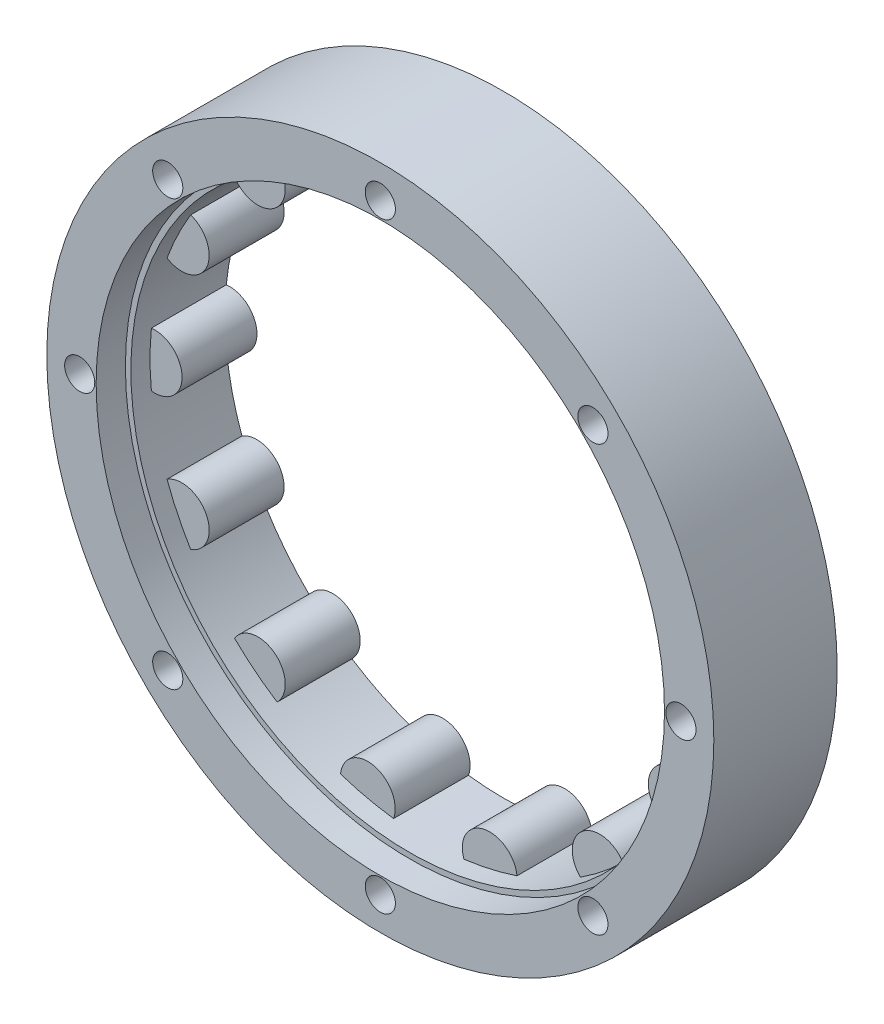
from build123d import *

# Parameters (mm, degrees)
PINSBASEEXTRUDE_DEPTH      = 0.2
PINSBASEEXTRUDE_DEPTH_BACK = 0.2
PINSBASESKETCH_R           = 33
PINSEXTRUDE_START          = -0.2
PINSSKETCH_R               = 3
PINSEXTRUDE_DEPTH          = 8.6
PINSPATTERN_COUNT          = 14
BOREREVOLVESKETCH_W        = 4
BOREREVOLVESKETCH_H        = 7.5
SKETCH_4_R                 = 33
CUT_EXTRUDE_1_DEPTH        = 0.4
SKETCH_5_R                 = 36.5
SKETCH_5_R_2               = 30.5
EXTRUDE_3_DEPTH            = 13.5
CUT_EXTRUDE_2_REACH        = 55.355
SKETCH_6_R                 = 1.65
SKETCH_8_R                 = 31.1
CUT_EXTRUDE_3_DEPTH        = 3.2


with BuildPart() as part:
    # PinsBaseSketch → PinsBaseExtrude (new, two sides: drawn at the far end of the back side and taken through both)
    with BuildSketch(Plane.XY.offset(-PINSBASEEXTRUDE_DEPTH_BACK)):
        Circle(PINSBASESKETCH_R)
    extrude(amount=PINSBASEEXTRUDE_DEPTH + PINSBASEEXTRUDE_DEPTH_BACK)

    # PinsSketch → PinsExtrude (add)
    with BuildSketch(Plane.XY.offset(PINSEXTRUDE_START)):
        with Locations((30, 0)):
            Circle(PINSSKETCH_R)
    pinsextrude = extrude(amount=PINSEXTRUDE_DEPTH)

    # PinsPattern: PinsExtrude ×14 about axis
    pinspattern_axis = Axis((0, 0, 55), (0, 0, -1))
    for i in range(1, PINSPATTERN_COUNT):
        add(pinsextrude.rotate(pinspattern_axis, i * 360 / PINSPATTERN_COUNT))

    # BoreRevolveSketch → BoreRevolveCut (revolve, cut)
    with BuildSketch(Plane(origin=(0, 0, 0), x_dir=(0, 0, -1), z_dir=(1, 0, 0))):
        with Locations((0, 3.75)):
            Rectangle(BOREREVOLVESKETCH_W, BOREREVOLVESKETCH_H)
    revolve(axis=Axis((0, 0, 0), (0, 0, -1)), mode=Mode.SUBTRACT)

    # 草图4 → 切除-拉伸1 (cut)
    with BuildSketch(Plane(origin=(0, 0, -0.2), x_dir=(-1, 0, 0), z_dir=(0, 0, -1))):
        Circle(SKETCH_4_R)
    extrude(amount=-CUT_EXTRUDE_1_DEPTH, mode=Mode.SUBTRACT)


with BuildPart() as cut_extrude_1_piece_1:
    # of the separate pieces the step leaves, piece 1, a body of its own (cut_extrude_1_pieces)
    add(part.part.solids().sort_by_distance((7.343190821, 32.172621102, 0.2))[0])



with BuildPart() as cut_extrude_1_piece_2:
    # of the separate pieces the step leaves, piece 2, a body of its own (cut_extrude_1_pieces)
    add(part.part.solids().sort_by_distance((20.575163461, -25.800438921, 0.2))[0])


with BuildPart() as cut_extrude_1_piece_3:
    # of the separate pieces the step leaves, piece 3, a body of its own (cut_extrude_1_pieces)
    add(part.part.solids().sort_by_distance((-7.343190821, 32.172621102, 0.2))[0])


with BuildPart() as cut_extrude_1_piece_4:
    # of the separate pieces the step leaves, piece 4, a body of its own (cut_extrude_1_pieces)
    add(part.part.solids().sort_by_distance((20.575163461, 25.800438921, 0.2))[0])


with BuildPart() as cut_extrude_1_piece_5:
    # of the separate pieces the step leaves, piece 5, a body of its own (cut_extrude_1_pieces)
    add(part.part.solids().sort_by_distance((29.731972641, 14.318163391, 0.2))[0])


with BuildPart() as cut_extrude_1_piece_6:
    # of the separate pieces the step leaves, piece 6, a body of its own (cut_extrude_1_pieces)
    add(part.part.solids().sort_by_distance((-7.343190821, -32.172621102, 0.2))[0])


with BuildPart() as cut_extrude_1_piece_7:
    # of the separate pieces the step leaves, piece 7, a body of its own (cut_extrude_1_pieces)
    add(part.part.solids().sort_by_distance((7.343190821, -32.172621102, 0.2))[0])


with BuildPart() as cut_extrude_1_piece_8:
    # of the separate pieces the step leaves, piece 8, a body of its own (cut_extrude_1_pieces)
    add(part.part.solids().sort_by_distance((29.731972641, -14.318163391, 0.2))[0])


with BuildPart() as cut_extrude_1_piece_9:
    # of the separate pieces the step leaves, piece 9, a body of its own (cut_extrude_1_pieces)
    add(part.part.solids().sort_by_distance((-29.731972641, -14.318163391, 0.2))[0])


with BuildPart() as cut_extrude_1_piece_10:
    # of the separate pieces the step leaves, piece 10, a body of its own (cut_extrude_1_pieces)
    add(part.part.solids().sort_by_distance((33, 0, 0.2))[0])


with BuildPart() as cut_extrude_1_piece_11:
    # of the separate pieces the step leaves, piece 11, a body of its own (cut_extrude_1_pieces)
    add(part.part.solids().sort_by_distance((-20.575163461, 25.800438921, 0.2))[0])


with BuildPart() as cut_extrude_1_piece_12:
    # of the separate pieces the step leaves, piece 12, a body of its own (cut_extrude_1_pieces)
    add(part.part.solids().sort_by_distance((-20.575163461, -25.800438921, 0.2))[0])


with BuildPart() as cut_extrude_1_piece_13:
    # of the separate pieces the step leaves, piece 13, a body of its own (cut_extrude_1_pieces)
    add(part.part.solids().sort_by_distance((-33, 0, 0.2))[0])


with BuildPart() as cut_extrude_1_piece_14:
    # of the separate pieces the step leaves, piece 14, a body of its own (cut_extrude_1_pieces)
    add(part.part.solids().sort_by_distance((-29.731972641, 14.318163391, 0.2))[0])


with BuildPart() as cut_extrude_1_piece_1_1:
    add(cut_extrude_1_piece_1.part)

    add(cut_extrude_1_piece_2.part)  # 凸台-拉伸3 merges 切除-拉伸1 piece 2

    add(cut_extrude_1_piece_3.part)  # 凸台-拉伸3 merges 切除-拉伸1 piece 3

    add(cut_extrude_1_piece_4.part)  # 凸台-拉伸3 merges 切除-拉伸1 piece 4

    add(cut_extrude_1_piece_5.part)  # 凸台-拉伸3 merges 切除-拉伸1 piece 5

    add(cut_extrude_1_piece_6.part)  # 凸台-拉伸3 merges 切除-拉伸1 piece 6

    add(cut_extrude_1_piece_7.part)  # 凸台-拉伸3 merges 切除-拉伸1 piece 7

    add(cut_extrude_1_piece_8.part)  # 凸台-拉伸3 merges 切除-拉伸1 piece 8

    add(cut_extrude_1_piece_9.part)  # 凸台-拉伸3 merges 切除-拉伸1 piece 9

    add(cut_extrude_1_piece_10.part)  # 凸台-拉伸3 merges 切除-拉伸1 piece 10

    add(cut_extrude_1_piece_11.part)  # 凸台-拉伸3 merges 切除-拉伸1 piece 11

    add(cut_extrude_1_piece_12.part)  # 凸台-拉伸3 merges 切除-拉伸1 piece 12

    add(cut_extrude_1_piece_13.part)  # 凸台-拉伸3 merges 切除-拉伸1 piece 13

    add(cut_extrude_1_piece_14.part)  # 凸台-拉伸3 merges 切除-拉伸1 piece 14
    # 草图5 → 凸台-拉伸3 (add)
    with BuildSketch(Plane(origin=(0, 0, 0.2), x_dir=(-1, 0, 0), z_dir=(0, 0, -1))):
        Circle(SKETCH_5_R)
        Circle(SKETCH_5_R_2, mode=Mode.SUBTRACT)
    extrude(amount=-EXTRUDE_3_DEPTH)

    # 草图6 → 切除-拉伸2 (cut, up to next)
    with BuildSketch(Plane.XY.offset(13.7), mode=Mode.PRIVATE) as cut_extrude_2_sk1:
        with Locations((32.899998742, 1.194e-06)):
            Circle(SKETCH_6_R)
    cut_extrude_2_tool1 = extrude(cut_extrude_2_sk1.sketch, amount=-CUT_EXTRUDE_2_REACH, mode=Mode.PRIVATE) & cut_extrude_1_piece_1_1.part
    # 草图6 → 切除-拉伸2 (cut, up to next)
    with BuildSketch(Plane.XY.offset(13.7), mode=Mode.PRIVATE) as cut_extrude_2_sk2:
        with Locations((23.263811843, -23.263811907)):
            Circle(SKETCH_6_R)
    cut_extrude_2_tool2 = extrude(cut_extrude_2_sk2.sketch, amount=-CUT_EXTRUDE_2_REACH, mode=Mode.PRIVATE) & cut_extrude_1_piece_1_1.part
    # 草图6 → 切除-拉伸2 (cut, up to next)
    with BuildSketch(Plane.XY.offset(13.7), mode=Mode.PRIVATE) as cut_extrude_2_sk3:
        with Locations((-1.258e-06, -32.899998806)):
            Circle(SKETCH_6_R)
    cut_extrude_2_tool3 = extrude(cut_extrude_2_sk3.sketch, amount=-CUT_EXTRUDE_2_REACH, mode=Mode.PRIVATE) & cut_extrude_1_piece_1_1.part
    # 草图6 → 切除-拉伸2 (cut, up to next)
    with BuildSketch(Plane.XY.offset(13.7), mode=Mode.PRIVATE) as cut_extrude_2_sk4:
        with Locations((-23.263814359, -23.263811907)):
            Circle(SKETCH_6_R)
    cut_extrude_2_tool4 = extrude(cut_extrude_2_sk4.sketch, amount=-CUT_EXTRUDE_2_REACH, mode=Mode.PRIVATE) & cut_extrude_1_piece_1_1.part
    # 草图6 → 切除-拉伸2 (cut, up to next)
    with BuildSketch(Plane.XY.offset(13.7), mode=Mode.PRIVATE) as cut_extrude_2_sk5:
        with Locations((-32.900001258, 1.194e-06)):
            Circle(SKETCH_6_R)
    cut_extrude_2_tool5 = extrude(cut_extrude_2_sk5.sketch, amount=-CUT_EXTRUDE_2_REACH, mode=Mode.PRIVATE) & cut_extrude_1_piece_1_1.part
    # 草图6 → 切除-拉伸2 (cut, up to next)
    with BuildSketch(Plane.XY.offset(13.7), mode=Mode.PRIVATE) as cut_extrude_2_sk6:
        with Locations((-23.263814359, 23.263814295)):
            Circle(SKETCH_6_R)
    cut_extrude_2_tool6 = extrude(cut_extrude_2_sk6.sketch, amount=-CUT_EXTRUDE_2_REACH, mode=Mode.PRIVATE) & cut_extrude_1_piece_1_1.part
    # 草图6 → 切除-拉伸2 (cut, up to next)
    with BuildSketch(Plane.XY.offset(13.7), mode=Mode.PRIVATE) as cut_extrude_2_sk7:
        with Locations((-1.258e-06, 32.900001194)):
            Circle(SKETCH_6_R)
    cut_extrude_2_tool7 = extrude(cut_extrude_2_sk7.sketch, amount=-CUT_EXTRUDE_2_REACH, mode=Mode.PRIVATE) & cut_extrude_1_piece_1_1.part
    # 草图6 → 切除-拉伸2 (cut, up to next)
    with BuildSketch(Plane.XY.offset(13.7), mode=Mode.PRIVATE) as cut_extrude_2_sk8:
        with Locations((23.263811843, 23.263814295)):
            Circle(SKETCH_6_R)
    cut_extrude_2_tool8 = extrude(cut_extrude_2_sk8.sketch, amount=-CUT_EXTRUDE_2_REACH, mode=Mode.PRIVATE) & cut_extrude_1_piece_1_1.part
    add(cut_extrude_2_tool1.solids().sort_by_distance((32.899999, 1e-06, 13.7))[0], mode=Mode.SUBTRACT)
    add(cut_extrude_2_tool2.solids().sort_by_distance((23.263812, -23.263812, 13.7))[0], mode=Mode.SUBTRACT)
    add(cut_extrude_2_tool3.solids().sort_by_distance((-1e-06, -32.899999, 13.7))[0], mode=Mode.SUBTRACT)
    add(cut_extrude_2_tool4.solids().sort_by_distance((-23.263814, -23.263812, 13.7))[0], mode=Mode.SUBTRACT)
    add(cut_extrude_2_tool5.solids().sort_by_distance((-32.900001, 1e-06, 13.7))[0], mode=Mode.SUBTRACT)
    add(cut_extrude_2_tool6.solids().sort_by_distance((-23.263814, 23.263814, 13.7))[0], mode=Mode.SUBTRACT)
    add(cut_extrude_2_tool7.solids().sort_by_distance((-1e-06, 32.900001, 13.7))[0], mode=Mode.SUBTRACT)
    add(cut_extrude_2_tool8.solids().sort_by_distance((23.263812, 23.263814, 13.7))[0], mode=Mode.SUBTRACT)

    # 草图8 → 切除-拉伸3 (cut)
    with BuildSketch(Plane.XY.offset(13.7)):
        with Locations((-1.258e-06, 1.194e-06)):
            Circle(SKETCH_8_R)
    extrude(amount=-CUT_EXTRUDE_3_DEPTH, mode=Mode.SUBTRACT)


solid = cut_extrude_1_piece_1_1.part
